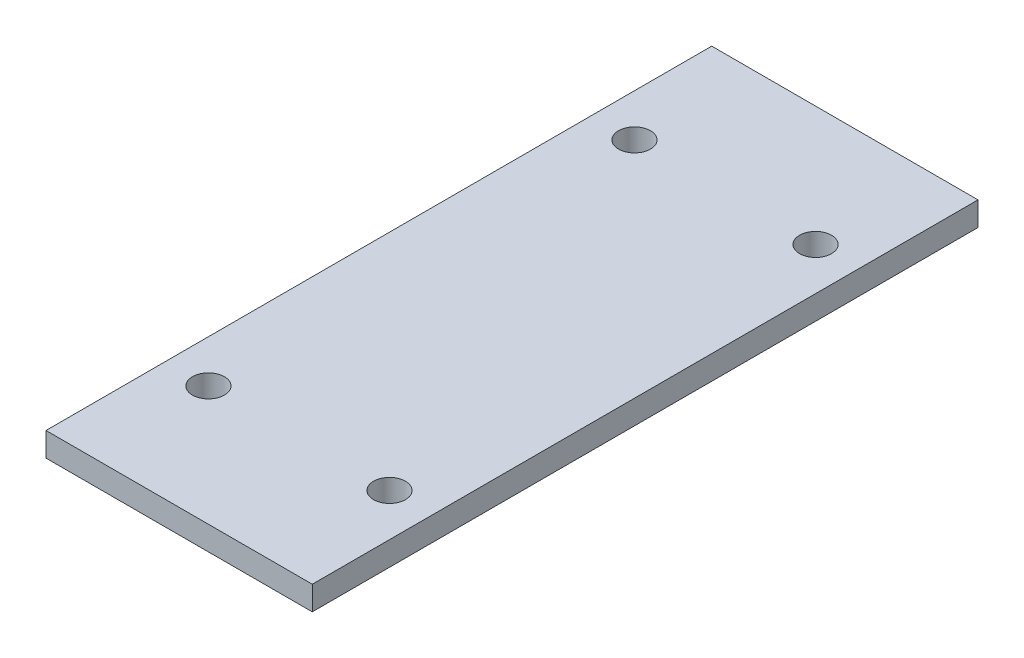
from build123d import *

# Parameters (mm, degrees)
SKETCH1_W           = 100
SKETCH1_H           = 9
BOSS_EXTRUDE1_DEPTH = 250
SKETCH2_R           = 6
CUT_EXTRUDE2_DEPTH  = 270.408611592


with BuildPart() as part:
    # Sketch1 → Boss-Extrude1 (new body)
    with BuildSketch(Plane.XY):
        with Locations((50, -4.5)):
            Rectangle(SKETCH1_W, SKETCH1_H)
    extrude(amount=BOSS_EXTRUDE1_DEPTH)

    # Sketch2 → Cut-Extrude2 (cut, through all)
    with BuildSketch(Plane(origin=(0, 0, 0), x_dir=(1, 0, 0), z_dir=(0, 1, 0))):
        with Locations(Location((16, -45, 0), (0, 0, 270))):
            Circle(SKETCH2_R)
        with Locations(Location((84, -45, 0), (0, 0, 270))):
            Circle(SKETCH2_R)
        with Locations(Location((16, -205, 0), (0, 0, 270))):
            Circle(SKETCH2_R)
        with Locations(Location((84, -205, 0), (0, 0, 270))):
            Circle(SKETCH2_R)
    extrude(amount=-CUT_EXTRUDE2_DEPTH, mode=Mode.SUBTRACT)


solid = part.part
